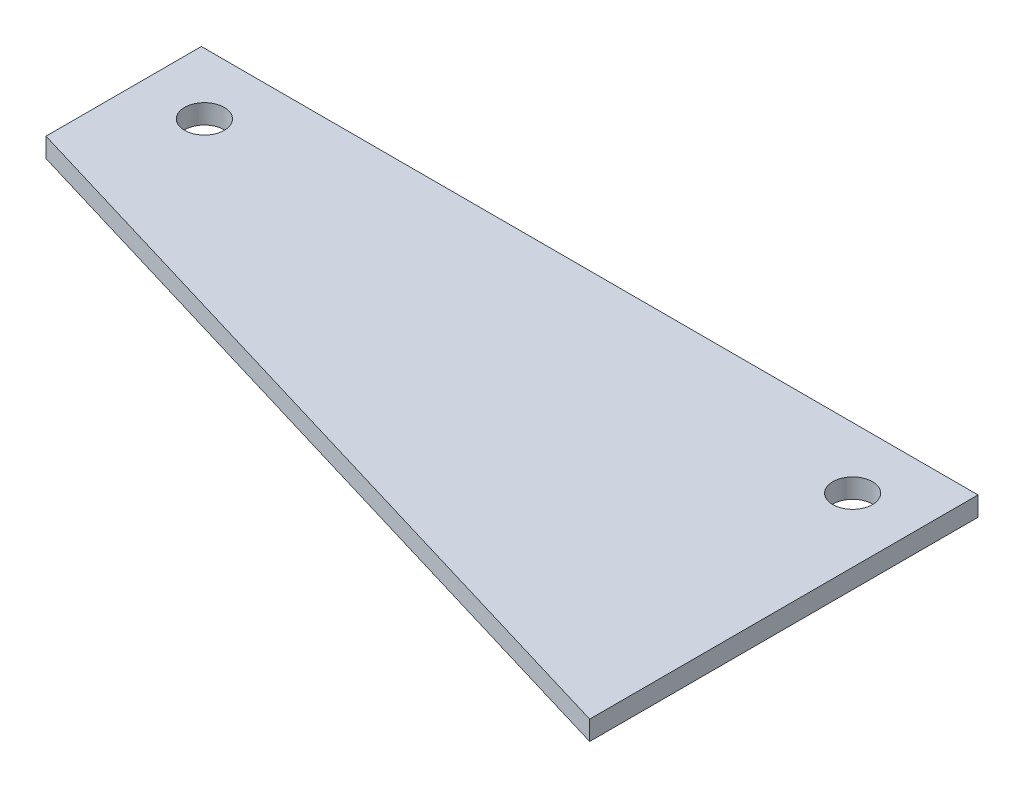
from build123d import *

# Parameters (mm, degrees)
SKETCH1_W           = 127
SKETCH1_H           = 76.2
BOSS_EXTRUDE1_DEPTH = 3.175
SKETCH2_R           = 3.25
CUT_EXTRUDE1_DEPTH  = 75.121121315


with BuildPart() as part:
    # Sketch1 → Boss-Extrude1 (new body)
    with BuildSketch(Plane(origin=(0, 0, 0), x_dir=(1, 0, 0), z_dir=(0, 1, 0))):
        Rectangle(SKETCH1_W, SKETCH1_H)
    extrude(amount=BOSS_EXTRUDE1_DEPTH)

    # Sketch2 → Cut-Extrude1 (cut, through all)
    with BuildSketch(Plane(origin=(0, 3.175, 0), x_dir=(1, 0, 0), z_dir=(0, 1, 0))):
        Polygon((63.5, -25.4), (-63.5, 12.7), (-63.5, -38.1), (63.5, -38.1), align=None)
        with Locations(Location((-53, 28.1, 0), (0, 0, 270))):
            Circle(SKETCH2_R)
        with Locations(Location((53, 28.1, 0), (0, 0, 270))):
            Circle(SKETCH2_R)
    extrude(amount=-CUT_EXTRUDE1_DEPTH, mode=Mode.SUBTRACT)


solid = part.part
